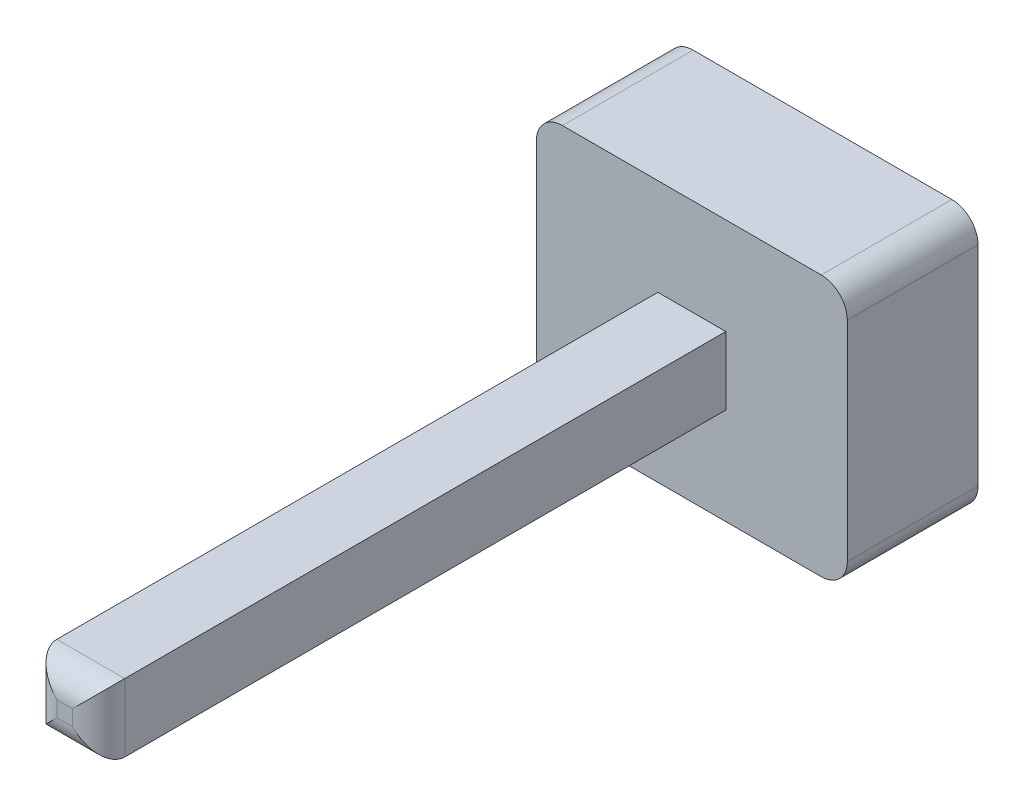
from build123d import *

# Parameters (mm, degrees)
BOSS_EXTRUDE1_DEPTH = 1.27
SKETCH2_W           = 0.6604
SKETCH2_H           = 0.6604
BOSS_EXTRUDE2_DEPTH = 6.096
FILLET1_R           = 0.254


with BuildPart() as part:
    # Sketch1 → Boss-Extrude1 (new body)
    with BuildSketch(Plane.XY.offset(1.27)):
        with BuildLine():
            Line((-0.663245498, 1.69205201), (-0.663245498, 3.72405201))
            ThreePointArc((-0.663245498, 3.72405201), (-0.737640375, 3.903657133), (-0.917245498, 3.97805201))
            Line((-0.917245498, 3.97805201), (-3.431845498, 3.97805201))
            ThreePointArc((-3.431845498, 3.97805201), (-3.61145062, 3.903657133), (-3.685845498, 3.72405201))
            Line((-3.685845498, 3.72405201), (-3.685845498, 1.69205201))
            ThreePointArc((-3.685845498, 1.69205201), (-3.61145062, 1.512446888), (-3.431845498, 1.43805201))
            Line((-3.431845498, 1.43805201), (-0.917245498, 1.43805201))
            ThreePointArc((-0.917245498, 1.43805201), (-0.737640375, 1.512446888), (-0.663245498, 1.69205201))
        make_face()
    extrude(amount=-BOSS_EXTRUDE1_DEPTH)

    # Sketch2 → Boss-Extrude2 (add)
    with BuildSketch(Plane.XY.offset(7.366)):
        with Locations((-2.174545498, 2.70805201)):
            Rectangle(SKETCH2_W, SKETCH2_H)
    extrude(amount=-BOSS_EXTRUDE2_DEPTH)

    # Fillet1
    fillet1_edges = [part.edges().sort_by_distance(p)[0] for p in [
        (-1.844345498, 2.70805201, 7.366),
        (-2.174545498, 3.03825201, 7.366),
        (-2.504745498, 2.70805201, 7.366),
        (-2.174545498, 2.37785201, 7.366),
    ]]
    fillet(fillet1_edges, radius=FILLET1_R)


solid = part.part
